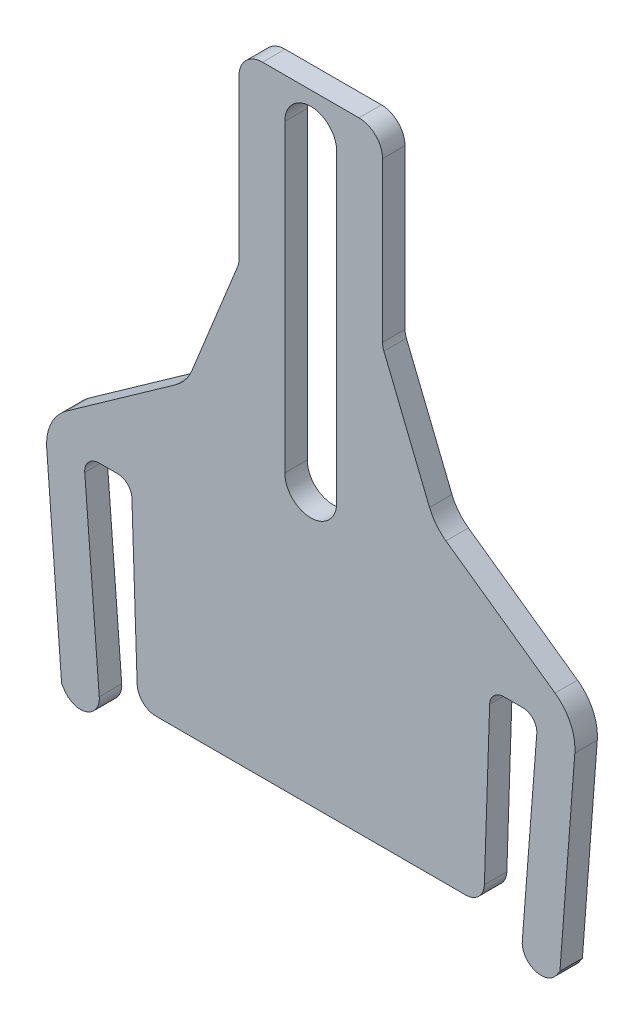
from build123d import *

# Parameters (mm, degrees)
SALIENTE_EXTRUIR1_DEPTH    = 2.38
REDONDEO1_R                = 4
REDONDEO2_R                = 4
REDONDEO3_R                = 4
REDONDEO4_R                = 3
CORTAR_EXTRUIR1_DEPTH      = 119.368571569
CORTAR_EXTRUIR1_DEPTH_BACK = 119.368571569
CORTAR_EXTRUIR2_DEPTH      = 119.368571569
SALIENTE_EXTRUIR2_DEPTH    = 4.76
REDONDEO5_R                = 10


with BuildPart() as part:
    # Croquis1 → Saliente-Extruir1 (new, symmetric)
    with BuildSketch(Plane.XY):
        with BuildLine():
            Line((5.5, 65.157151242), (15.208163591, 65.157151242))
            Line((15.208163591, 65.157151242), (15.208163591, 103.706209284))
            Line((15.208163591, 103.706209284), (-15.208163591, 103.706209284))
            Line((-15.208163591, 103.706209284), (-15.208163591, 65.157151242))
            Line((-15.208163591, 65.157151242), (-5.5, 65.157151242))
            Line((-5.5, 65.157151242), (-5.5, 82.556930634))
            ThreePointArc((-5.5, 82.556930634), (0, 88.056930634), (5.5, 82.556930634))
            Line((5.5, 82.556930634), (5.5, 65.157151242))
        make_face()
        with BuildLine():
            Line((56.996730438, 25.832022394), (15.208163591, 65.157151242))
            Line((15.208163591, 65.157151242), (5.5, 65.157151242))
            Line((5.5, 65.157151242), (5.5, 42.556930634))
            ThreePointArc((5.5, 42.556930634), (0, 37.056930634), (-5.5, 42.556930634))
            Line((-5.5, 42.556930634), (-5.5, 65.157151242))
            Line((-5.5, 65.157151242), (-15.208163591, 65.157151242))
            Line((-15.208163591, 65.157151242), (-56.996730438, 25.832022394))
            Line((-56.996730438, 25.832022394), (-52.784065, -29.74367502))
            Line((-52.784065, -29.74367502), (-43.642993924, -43.246554306))
            Line((-43.642993924, -43.246554306), (-48.133553694, 14.690410374))
            Line((-48.133553694, 14.690410374), (-37.992388192, 14.690410374))
            Line((-37.992388192, 14.690410374), (-36.652824186, -25.733224315))
            Line((-36.652824186, -25.733224315), (36.652824186, -25.733224315))
            Line((36.652824186, -25.733224315), (37.992388192, 14.690410374))
            Line((37.992388192, 14.690410374), (48.133553694, 14.690410374))
            Line((48.133553694, 14.690410374), (43.642993924, -43.246554306))
            Line((43.642993924, -43.246554306), (52.784065, -29.74367502))
            Line((52.784065, -29.74367502), (56.996730438, 25.832022394))
        make_face()
    extrude(amount=SALIENTE_EXTRUIR1_DEPTH, both=True)

    # Redondeo1
    redondeo1_edges = [part.edges().sort_by_distance(p)[0] for p in [
        (43.642993924, -43.246554306, 0),
        (-43.642993924, -43.246554306, 0),
    ]]
    fillet(redondeo1_edges, radius=REDONDEO1_R)

    # Redondeo2
    redondeo2_edges = [part.edges().sort_by_distance(p)[0] for p in [
        (36.652824186, -25.733224315, 0),
        (-36.652824186, -25.733224315, 0),
    ]]
    fillet(redondeo2_edges, radius=REDONDEO2_R)

    # Redondeo3
    redondeo3_edges = [part.edges().sort_by_distance(p)[0] for p in [
        (56.996730438, 25.832022394, 0),
        (-56.996730438, 25.832022394, 0),
        (-15.208163591, 65.157151242, 0),
        (-15.208163591, 103.706209284, 0),
        (15.208163591, 103.706209284, 0),
        (15.208163591, 65.157151242, 0),
    ]]
    fillet(redondeo3_edges, radius=REDONDEO3_R)

    # Redondeo4
    redondeo4_edges = [part.edges().sort_by_distance(p)[0] for p in [
        (48.133553694, 14.690410374, 0),
        (37.992388192, 14.690410374, 0),
        (-37.992388192, 14.690410374, 0),
        (-48.133553694, 14.690410374, 0),
    ]]
    fillet(redondeo4_edges, radius=REDONDEO4_R)

    # Croquis2 → Cortar-Extruir1 (cut, two sides: drawn at the far end of the back side and taken through both)
    with BuildSketch(Plane(origin=(0, 0, -2.38), x_dir=(-1, 0, 0), z_dir=(0, 0, -1)).offset(-CORTAR_EXTRUIR1_DEPTH_BACK)):
        with BuildLine():
            Line((5.5, 82.556930634), (5.5, 12.556930634))
            ThreePointArc((5.5, 12.556930634), (0, 7.056930634), (-5.5, 12.556930634))
            Line((-5.5, 12.556930634), (-5.5, 82.556930634))
            ThreePointArc((-5.5, 82.556930634), (0, 88.056930634), (5.5, 82.556930634))
        make_face()
    extrude(amount=CORTAR_EXTRUIR1_DEPTH + CORTAR_EXTRUIR1_DEPTH_BACK, mode=Mode.SUBTRACT)

    # Croquis3 → Cortar-Extruir2 (cut, through all)
    with BuildSketch(Plane.XY.offset(2.38)):
        with BuildLine():
            Line((-56.366042887, 17.511660625), (-28.64196137, 37.147983648))
            ThreePointArc((-28.64196137, 37.147983648), (-26.58175129, 39.100934084), (-25.153332254, 41.554115699))
            Line((-25.153332254, 41.554115699), (-15.50076552, 65.383868903))
            ThreePointArc((-15.50076552, 65.383868903), (-15.281995467, 66.120614903), (-15.208163591, 66.885601085))
            Line((-15.208163591, 66.885601085), (-15.208163591, 82.556930634))
            Line((-15.208163591, 82.556930634), (15.208163591, 82.556930634))
            Line((15.208163591, 82.556930634), (15.208163591, 66.885601085))
            ThreePointArc((15.208163591, 66.885601085), (15.281995467, 66.120614903), (15.50076552, 65.383868903))
            Line((15.50076552, 65.383868903), (25.153332254, 41.554115699))
            ThreePointArc((25.153332254, 41.554115699), (26.58175129, 39.100934084), (28.64196137, 37.147983648))
            Line((28.64196137, 37.147983648), (56.366042887, 17.511660625))
            Line((56.366042887, 17.511660625), (71.467091409, 17.511660625))
            Line((71.467091409, 17.511660625), (71.467091409, 120.054882747))
            Line((71.467091409, 120.054882747), (-63.851265514, 120.054882747))
            Line((-63.851265514, 120.054882747), (-63.851265514, 17.511660625))
            Line((-63.851265514, 17.511660625), (-56.366042887, 17.511660625))
        make_face()
    extrude(amount=-CORTAR_EXTRUIR2_DEPTH, mode=Mode.SUBTRACT)

    # Croquis4 → Saliente-Extruir2 (add)
    with BuildSketch(Plane.XY.offset(2.38)):
        with BuildLine():
            Line((-5.5, 32.556930634), (-5.5, 0))
            Line((-5.5, 0), (5.5, 0))
            Line((5.5, 0), (5.5, 32.556930634))
            ThreePointArc((5.5, 32.556930634), (0, 27.056930634), (-5.5, 32.556930634))
        make_face()
        with BuildLine():
            Line((5.5, 97.056930634), (5.5, 82.556930634))
            Line((5.5, 82.556930634), (15.208163591, 82.556930634))
            Line((15.208163591, 82.556930634), (15.208163591, 100.556930634))
            ThreePointArc((15.208163591, 100.556930634), (13.743697497, 104.09246454), (10.208163591, 105.556930634))
            Line((10.208163591, 105.556930634), (-10.208163591, 105.556930634))
            ThreePointArc((-10.208163591, 105.556930634), (-13.743697497, 104.09246454), (-15.208163591, 100.556930634))
            Line((-15.208163591, 100.556930634), (-15.208163591, 82.556930634))
            Line((-15.208163591, 82.556930634), (-5.5, 82.556930634))
            Line((-5.5, 82.556930634), (-5.5, 97.056930634))
            ThreePointArc((-5.5, 97.056930634), (0, 102.556930634), (5.5, 97.056930634))
        make_face()
    extrude(amount=-SALIENTE_EXTRUIR2_DEPTH)

    # Redondeo5
    redondeo5_edges = [part.edges().sort_by_distance(p)[0] for p in [
        (-56.366042887, 17.511660625, 0),
        (56.366042887, 17.511660625, 0),
    ]]
    fillet(redondeo5_edges, radius=REDONDEO5_R)


solid = part.part
